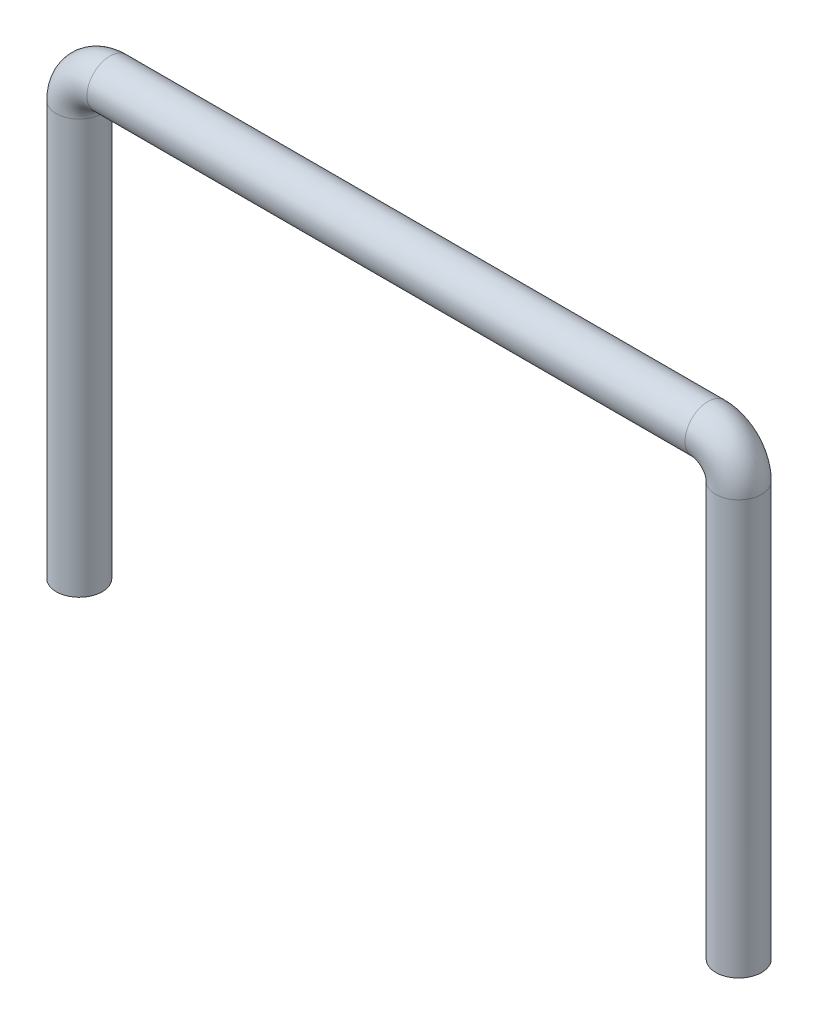
from build123d import *

# Parameters (mm, degrees)
SKETCH2_R = 7.5


with BuildPart() as part:
    # Sweep1: sweep along a path in Sketch1
    with BuildLine(Plane.XY) as sweep1_path:
        Line((-130.416139423, 0), (-130.416139423, 135))
        ThreePointArc((-130.416139423, 135), (-127.487207235, 142.071067812), (-120.416139423, 145))
        Line((-120.416139423, 145), (74.583860577, 145))
        ThreePointArc((74.583860577, 145), (81.654928388, 142.071067812), (84.583860577, 135))
        Line((84.583860577, 135), (84.583860577, 0))
    # Sketch2 → Sweep1 (sweep)
    with BuildSketch(Plane(origin=(0, 0, 0), x_dir=(1, 0, 0), z_dir=(0, 1, 0))):
        with Locations((-130.416139423, 0)):
            Circle(SKETCH2_R)
    sweep(path=sweep1_path.line)


solid = part.part
